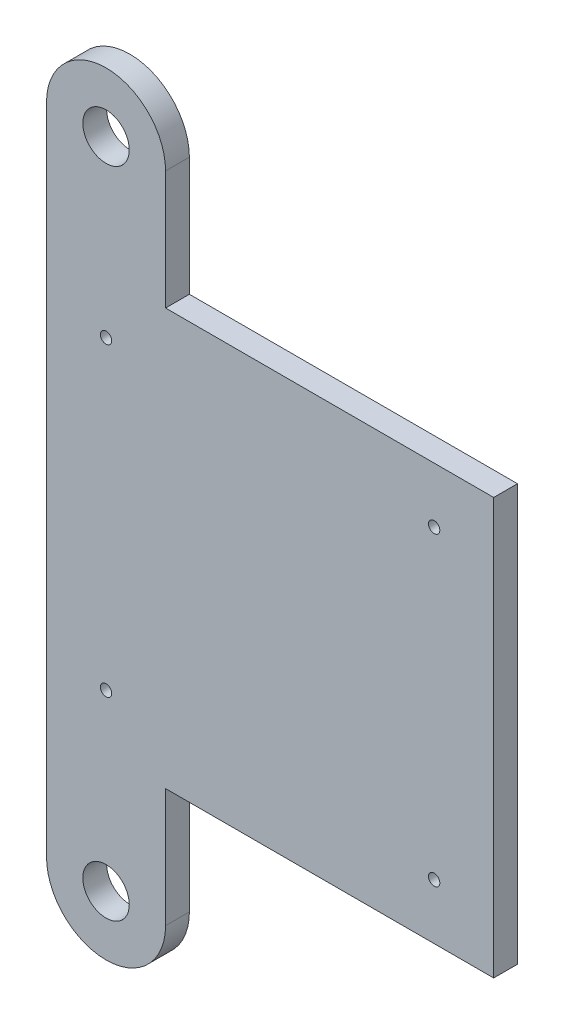
from build123d import *

# Parameters (mm, degrees)
SKETCH1_W                      = 27.56
SKETCH1_H                      = 34.956966618
BOSS_EXTRUDE1_DEPTH            = 2
TAP_DRILL_FOR_M1_2X0_25_TAP2_D = 0.95
M3_5_CLEARANCE_HOLE1_D         = 3.9


with BuildPart() as part:
    # Sketch1 → Boss-Extrude1 (new body)
    with BuildSketch(Plane.XY):
        with Locations((5, 0)):
            Rectangle(SKETCH1_W, SKETCH1_H)
        Polygon((-18.78, -10), (-18.78, -17.478483309), (-8.78, -17.478483309), (-8.78, 17.478483309), (-18.78, 17.478483309), (-18.78, 10), align=None)
        with BuildLine():
            Line((-18.78, 17.478483309), (-8.78, 17.478483309))
            Line((-8.78, 17.478483309), (-8.78, 27.45))
            ThreePointArc((-8.78, 27.45), (-13.78, 32.45), (-18.78, 27.45))
            Line((-18.78, 27.45), (-18.78, 17.478483309))
        make_face()
        with BuildLine():
            Line((-8.78, -17.478483309), (-18.78, -17.478483309))
            Line((-18.78, -17.478483309), (-18.78, -27.45))
            ThreePointArc((-18.78, -27.45), (-13.78, -32.45), (-8.78, -27.45))
            Line((-8.78, -27.45), (-8.78, -17.478483309))
        make_face()
    extrude(amount=BOSS_EXTRUDE1_DEPTH)

    # Tap Drill for M1.2x0.25 Tap2 (through all)
    with Locations(Plane.XY.offset(2)):
        with Locations((-13.78, -12.825), (-13.78, 12.825), (13.78, 12.825), (13.78, -12.825)):
            Hole(TAP_DRILL_FOR_M1_2X0_25_TAP2_D / 2)

    # M3.5 Clearance Hole1 (through all)
    with Locations(Plane.XY.offset(2)):
        with Locations((-13.78, -27.45), (-13.78, 27.45)):
            Hole(M3_5_CLEARANCE_HOLE1_D / 2)


solid = part.part
